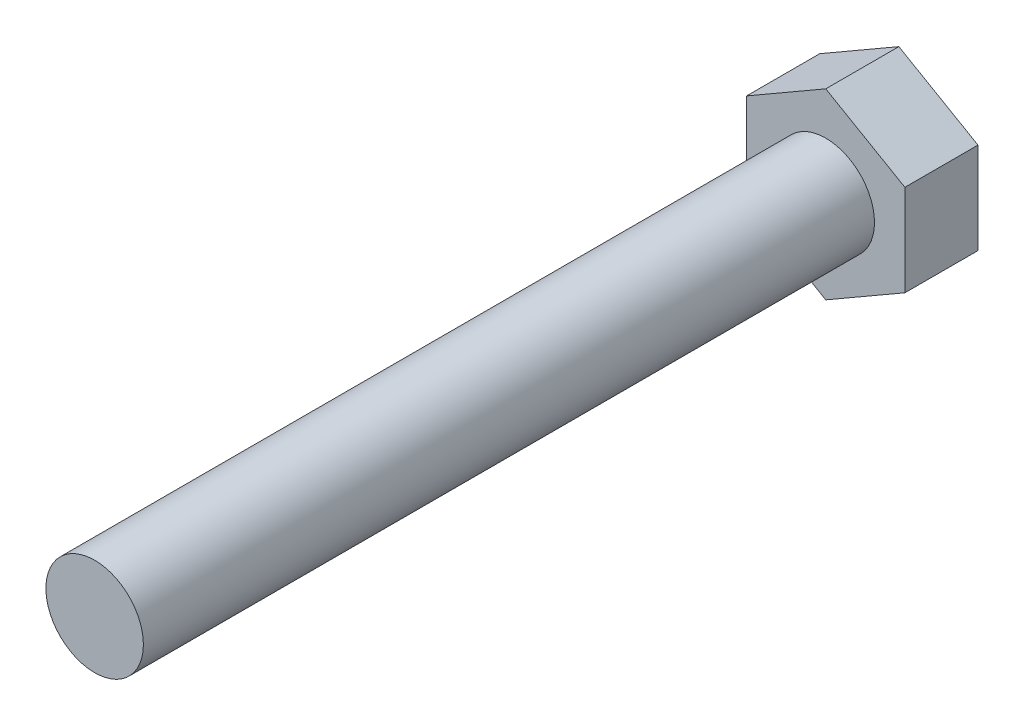
from build123d import *

# Parameters (mm, degrees)
BOSS_EXTRUDE1_DEPTH         = 6
SKETCH2_R                   = 4
LONGITUD_DE_TORNILLLO_DEPTH = 60


with BuildPart() as part:
    # Sketch1 → Boss-Extrude1 (new body)
    with BuildSketch(Plane.XY):
        Polygon((0, 7.5), (-6.495190528, 3.75), (-6.495190528, -3.75), (0, -7.5), (6.495190528, -3.75), (6.495190528, 3.75), align=None)
    extrude(amount=BOSS_EXTRUDE1_DEPTH)

    # Sketch2 → Longitud de tornilllo (add)
    with BuildSketch(Plane.XY.offset(6)):
        Circle(SKETCH2_R)
    extrude(amount=LONGITUD_DE_TORNILLLO_DEPTH)


solid = part.part
